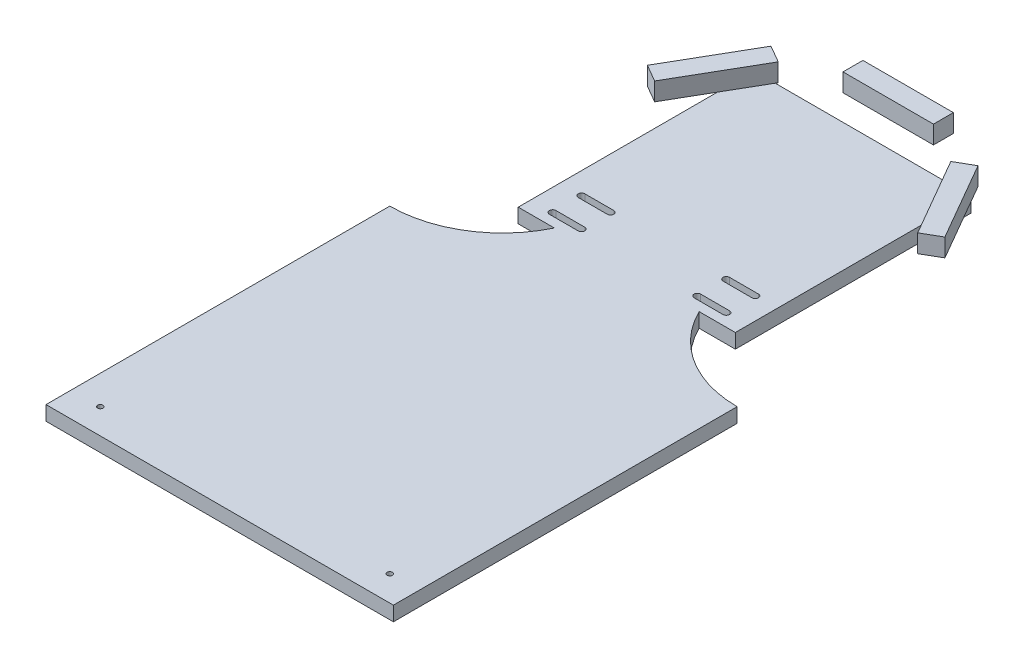
from build123d import *

# Parameters (mm, degrees)
EXTRUDE_1_DEPTH     = 8
SKETCH_2_W          = 50
SKETCH_2_H          = 11
EXTRUDE_2_DEPTH     = 10
SKETCH_4_R          = 1.45
CUT_EXTRUDE_1_DEPTH = 259.681271065


with BuildPart() as part:
    # 草图1 → 凸台-拉伸1 (new body)
    with BuildSketch(Plane(origin=(0, 0, 0), x_dir=(1, 0, 0), z_dir=(0, 1, 0))):
        with BuildLine():
            Line((-60, 15), (-60, -15))
            Line((-60, -15), (-40, -15))
            ThreePointArc((-40, -15), (-62.981066038, -40.53029434), (-96, -50))
            Line((-96, -50), (-96, -240))
            Line((-96, -240), (-40, -240))
            Line((-40, -240), (40, -240))
            Line((40, -240), (96, -240))
            Line((96, -240), (96, -50))
            ThreePointArc((96, -50), (62.981066038, -40.53029434), (40, -15))
            Line((40, -15), (60, -15))
            Line((60, -15), (60, 15))
            Line((60, 15), (60, 115.340483965))
            Line((60, 115.340483965), (-60, 115.340483965))
            Line((-60, 115.340483965), (-60, 15))
        make_face()
        with BuildLine():
            Line((-48, 9.8), (-32, 9.8))
            ThreePointArc((-32, 9.8), (-30.2, 8), (-32, 6.2))
            Line((-32, 6.2), (-48, 6.2))
            ThreePointArc((-48, 6.2), (-49.8, 8), (-48, 9.8))
        make_face(mode=Mode.SUBTRACT)
        with BuildLine():
            Line((-48, -9.8), (-32, -9.8))
            ThreePointArc((-32, -9.8), (-30.2, -8), (-32, -6.2))
            Line((-32, -6.2), (-48, -6.2))
            ThreePointArc((-48, -6.2), (-49.8, -8), (-48, -9.8))
        make_face(mode=Mode.SUBTRACT)
        with BuildLine():
            Line((48, 9.8), (32, 9.8))
            ThreePointArc((32, 9.8), (30.2, 8), (32, 6.2))
            Line((32, 6.2), (48, 6.2))
            ThreePointArc((48, 6.2), (49.8, 8), (48, 9.8))
        make_face(mode=Mode.SUBTRACT)
        with BuildLine():
            Line((48, -9.8), (32, -9.8))
            ThreePointArc((32, -9.8), (30.2, -8), (32, -6.2))
            Line((32, -6.2), (48, -6.2))
            ThreePointArc((48, -6.2), (49.8, -8), (48, -9.8))
        make_face(mode=Mode.SUBTRACT)
    extrude(amount=-EXTRUDE_1_DEPTH)

    # 草图2 → 凸台-拉伸2 (add)
    with BuildSketch(Plane(origin=(0, 0, 0), x_dir=(1, 0, 0), z_dir=(0, 1, 0))):
        Polygon((72.688765563, 73.099364905), (82.215045005, 78.599364905), (57.215045005, 121.900635095), (47.688765563, 116.400635095), align=None)
        Polygon((-47.688765563, 116.400635095), (-57.215045005, 121.900635095), (-82.215045005, 78.599364905), (-72.688765563, 73.099364905), align=None)
        with Locations((0, 135)):
            Rectangle(SKETCH_2_W, SKETCH_2_H)
    extrude(amount=EXTRUDE_2_DEPTH)


with BuildPart() as extrude_2_piece_1:
    # of the separate pieces the step leaves, piece 1, a body of its own (extrude_2_pieces)
    add(part.part.solids().sort_by_distance((40, 0, 15))[0])

    # 草图4 → 切除-拉伸1 (cut, through all)
    with BuildSketch(Plane(origin=(0, 0, 0), x_dir=(1, 0, 0), z_dir=(0, 1, 0))):
        with Locations(Location((-80, -226, 0), (0, 0, 270))):
            Circle(SKETCH_4_R)
        with Locations(Location((80, -226, 0), (0, 0, 90))):
            Circle(SKETCH_4_R)
    extrude(amount=-CUT_EXTRUDE_1_DEPTH, mode=Mode.SUBTRACT)


with BuildPart() as extrude_2_piece_2:
    # of the separate pieces the step leaves, piece 2, a body of its own (extrude_2_pieces)
    add(part.part.solids().sort_by_distance((25, 0, -129.5))[0])


solid = Compound([extrude_2_piece_1.part, extrude_2_piece_2.part])
